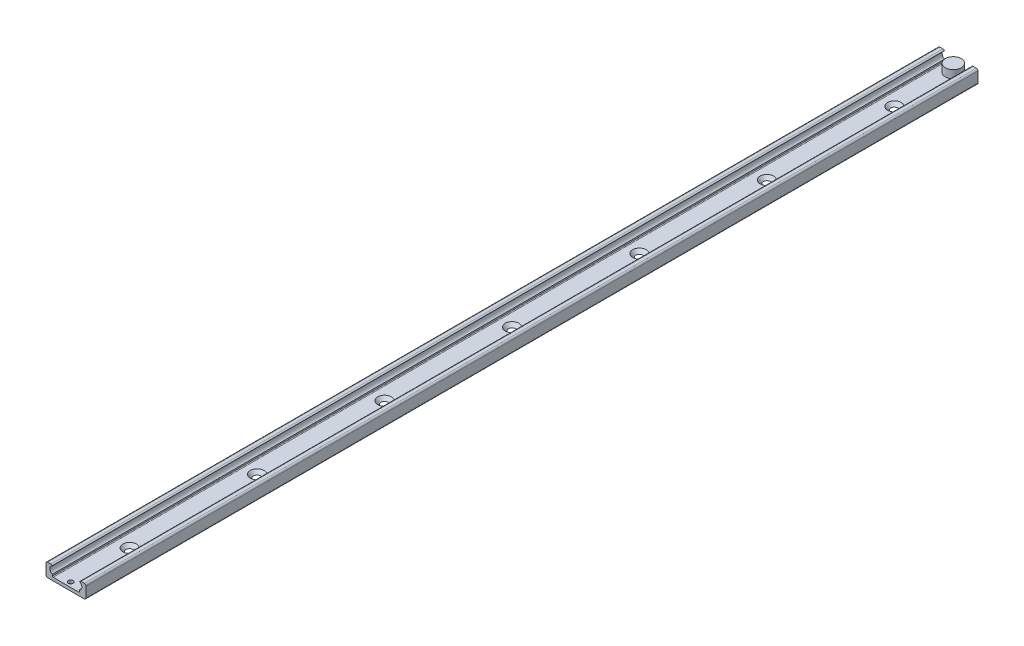
from build123d import *

# Parameters (mm, degrees)
EXTRUDE_1_DEPTH          = 720
SKETCH_3_R               = 5
EXTRUDE_3_DEPTH          = 5
HOLE_WIZARD_1_AT_2_COUNT = 2
HOLE_WIZARD_1_AT_2_PITCH = 640
HOLE_WIZARD_1_AT_3_COUNT = 2
HOLE_WIZARD_1_AT_3_PITCH = 560
HOLE_WIZARD_1_AT_4_COUNT = 2
HOLE_WIZARD_1_AT_4_PITCH = 480
HOLE_WIZARD_1_AT_5_COUNT = 2
HOLE_WIZARD_1_AT_5_PITCH = 400
HOLE_WIZARD_1_AT_6_COUNT = 2
HOLE_WIZARD_1_AT_6_PITCH = 320
HOLE_WIZARD_1_AT_7_COUNT = 2
HOLE_WIZARD_1_AT_7_PITCH = 240
HOLE_WIZARD_1_AT_8_COUNT = 2
HOLE_WIZARD_1_AT_8_PITCH = 160
HOLE_WIZARD_1_AT_9_COUNT = 2
HOLE_WIZARD_1_AT_9_PITCH = 80
FILLET_1_R               = 0.5
FILLET_2_R               = 1
SKETCH_6_W               = 28.389485075
SKETCH_6_H               = 8.5
CUT_EXTRUDE_1_DEPTH      = 160
SKETCH_7_R               = 1.5
CUT_EXTRUDE_2_DEPTH      = 561.177204106


with BuildPart() as part:
    # ｽｹｯﾁ1 → ﾎﾞｽ - 押し出し1 (new body)
    with BuildSketch(Plane.XY.offset(720)):
        with BuildLine():
            Line((8.5, 3.408712153), (8.5, 2))
            Line((8.5, 2), (-8.5, 2))
            Line((-8.5, 2), (-8.5, 3.408712153))
            ThreePointArc((-8.5, 3.408712153), (-9.999347871, 5.642901666), (-8.603592403, 7.943230663))
            ThreePointArc((-8.603592403, 7.943230663), (-8.97237829, 8.349479447), (-9.5, 8.5))
            Line((-9.5, 8.5), (-12.5, 8.5))
            Line((-12.5, 8.5), (-12.5, 0))
            Line((-12.5, 0), (12.5, 0))
            Line((12.5, 0), (12.5, 8.5))
            Line((12.5, 8.5), (9.5, 8.5))
            ThreePointArc((9.5, 8.5), (8.97237829, 8.349479447), (8.603592403, 7.943230663))
            ThreePointArc((8.603592403, 7.943230663), (9.999347871, 5.642901666), (8.5, 3.408712153))
        make_face()
    extrude(amount=-EXTRUDE_1_DEPTH)

    # ｽｹｯﾁ3 → ﾎﾞｽ - 押し出し3 (add)
    with BuildSketch(Plane(origin=(0, 2, 0), x_dir=(-1, 0, 0), z_dir=(0, 1, 0))):
        with Locations(Location((0, 3, 0), (0, 0, 323.130102354))):
            Circle(SKETCH_3_R)
    extrude(amount=EXTRUDE_3_DEPTH)

    # ｽｹｯﾁ4 → 穴1 (revolve, cut)
    with BuildSketch(Plane(origin=(0, 2, 40), x_dir=(0, 0, 1), z_dir=(1, 0, 0))):
        Polygon((0, 0), (0, 2), (2.25, 2), (4.25, 0), align=None)
    hole_wizard_1 = revolve(axis=Axis((0, -108, 40), (0, 1, 0)), mode=Mode.SUBTRACT)

    # 穴1 at 2: 穴1 ×2
    with Locations(*[(0, 0, i * HOLE_WIZARD_1_AT_2_PITCH) for i in range(1, HOLE_WIZARD_1_AT_2_COUNT)]):
        add(hole_wizard_1, mode=Mode.SUBTRACT)

    # 穴1 at 3: 穴1 ×2
    with Locations(*[(0, 0, i * HOLE_WIZARD_1_AT_3_PITCH) for i in range(1, HOLE_WIZARD_1_AT_3_COUNT)]):
        add(hole_wizard_1, mode=Mode.SUBTRACT)

    # 穴1 at 4: 穴1 ×2
    with Locations(*[(0, 0, i * HOLE_WIZARD_1_AT_4_PITCH) for i in range(1, HOLE_WIZARD_1_AT_4_COUNT)]):
        add(hole_wizard_1, mode=Mode.SUBTRACT)

    # 穴1 at 5: 穴1 ×2
    with Locations(*[(0, 0, i * HOLE_WIZARD_1_AT_5_PITCH) for i in range(1, HOLE_WIZARD_1_AT_5_COUNT)]):
        add(hole_wizard_1, mode=Mode.SUBTRACT)

    # 穴1 at 6: 穴1 ×2
    with Locations(*[(0, 0, i * HOLE_WIZARD_1_AT_6_PITCH) for i in range(1, HOLE_WIZARD_1_AT_6_COUNT)]):
        add(hole_wizard_1, mode=Mode.SUBTRACT)

    # 穴1 at 7: 穴1 ×2
    with Locations(*[(0, 0, i * HOLE_WIZARD_1_AT_7_PITCH) for i in range(1, HOLE_WIZARD_1_AT_7_COUNT)]):
        add(hole_wizard_1, mode=Mode.SUBTRACT)

    # 穴1 at 8: 穴1 ×2
    with Locations(*[(0, 0, i * HOLE_WIZARD_1_AT_8_PITCH) for i in range(1, HOLE_WIZARD_1_AT_8_COUNT)]):
        add(hole_wizard_1, mode=Mode.SUBTRACT)

    # 穴1 at 9: 穴1 ×2
    with Locations(*[(0, 0, i * HOLE_WIZARD_1_AT_9_PITCH) for i in range(1, HOLE_WIZARD_1_AT_9_COUNT)]):
        add(hole_wizard_1, mode=Mode.SUBTRACT)

    # ﾌｨﾚｯﾄ1
    fillet_1_edges = [part.edges().sort_by_distance(p)[0] for p in [
        (-8.5, 2, 360),
        (8.5, 2, 360),
    ]]
    fillet(fillet_1_edges, radius=FILLET_1_R)

    # ﾌｨﾚｯﾄ2
    fillet_2_edges = [part.edges().sort_by_distance(p)[0] for p in [
        (12.5, 8.5, 360),
        (12.5, 0, 360),
        (-12.5, 0, 360),
        (-12.5, 8.5, 360),
    ]]
    fillet(fillet_2_edges, radius=FILLET_2_R)

    # ｽｹｯﾁ6 → ｶｯﾄ - 押し出し1 (cut)
    with BuildSketch(Plane.XY.offset(720)):
        with Locations((-0.090556571, 4.25)):
            Rectangle(SKETCH_6_W, SKETCH_6_H)
    extrude(amount=-CUT_EXTRUDE_1_DEPTH, mode=Mode.SUBTRACT)

    # ｽｹｯﾁ7 → ｶｯﾄ - 押し出し2 (cut, through all)
    with BuildSketch(Plane(origin=(0, 2, 0), x_dir=(1, 0, 0), z_dir=(0, 1, 0))):
        with Locations(Location((0, -557, 0), (0, 0, 270))):
            Circle(SKETCH_7_R)
    extrude(amount=-CUT_EXTRUDE_2_DEPTH, mode=Mode.SUBTRACT)


solid = part.part
